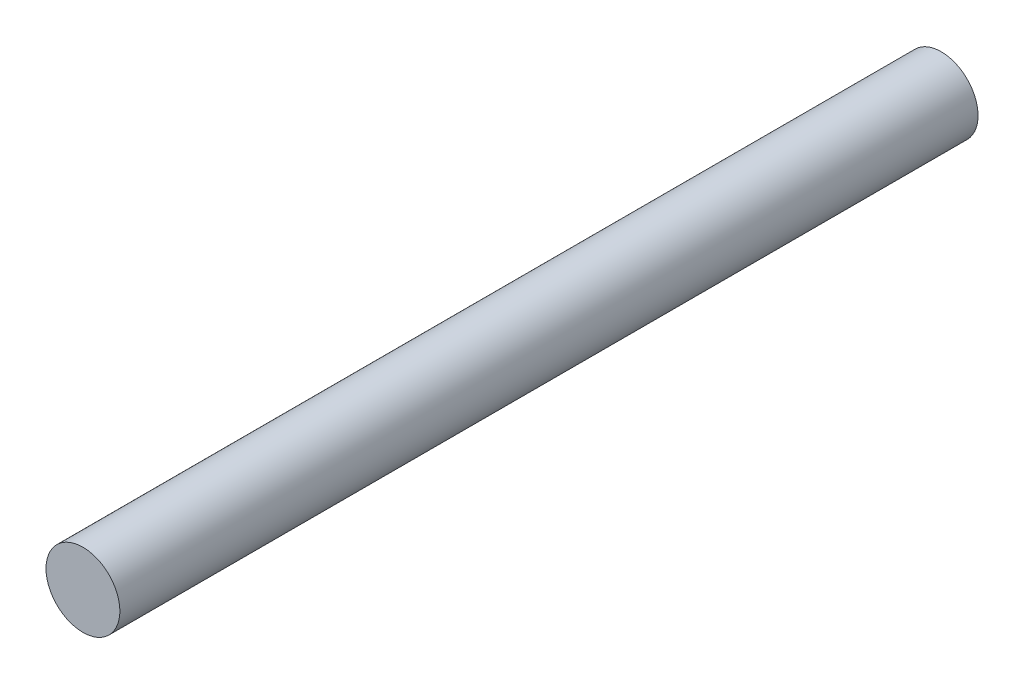
from build123d import *

# Parameters (mm, degrees)
SKETCH1_R           = 4
BOSS_EXTRUDE1_DEPTH = 93


with BuildPart() as part:
    # Sketch1 → Boss-Extrude1 (new body)
    with BuildSketch(Plane.XY):
        with Locations(Location((0, 0, 0), (0, 0, 180))):
            Circle(SKETCH1_R)
    extrude(amount=BOSS_EXTRUDE1_DEPTH)


solid = part.part
